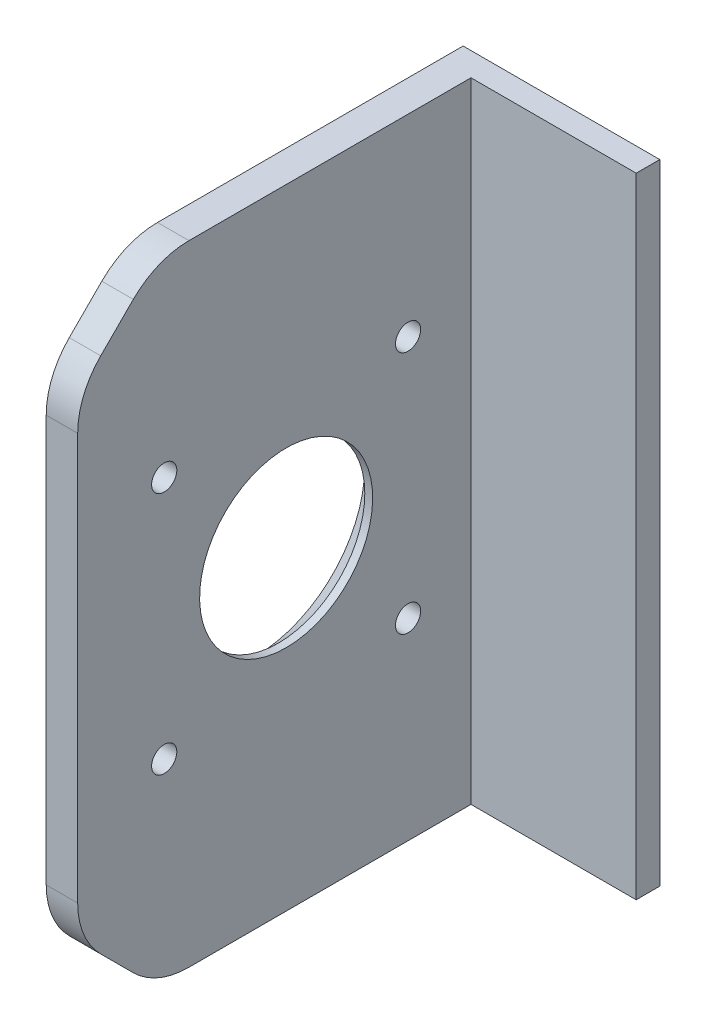
from build123d import *

# Parameters (mm, degrees)
CROQUIS1_W              = 25
CROQUIS1_H              = 80
SALIENTE_EXTRUIR1_DEPTH = 3
CROQUIS2_W              = 4
CROQUIS2_H              = 80
SALIENTE_EXTRUIR2_DEPTH = 50
CHAFL_N1_SIZE           = 10
REDONDEO1_R             = 10
CROQUIS3_R              = 1.6
CROQUIS3_R_2            = 11
CORTAR_EXTRUIR1_DEPTH   = 50
CHAFL_N2_SIZE           = 3


with BuildPart() as part:
    # Croquis1 → Saliente-Extruir1 (new body)
    with BuildSketch(Plane.XY):
        Rectangle(CROQUIS1_W, CROQUIS1_H)
    extrude(amount=SALIENTE_EXTRUIR1_DEPTH)

    # Croquis2 → Saliente-Extruir2 (add)
    with BuildSketch(Plane.XY.offset(3)):
        with Locations((-10.5, 0)):
            Rectangle(CROQUIS2_W, CROQUIS2_H)
    extrude(amount=SALIENTE_EXTRUIR2_DEPTH)

    # Chaflán1
    chafl_n1_edges = [part.edges().sort_by_distance(p)[0] for p in [
        (-10.5, -40, 53),
        (-10.5, 40, 53),
    ]]
    chamfer(chafl_n1_edges, length=CHAFL_N1_SIZE)

    # Redondeo1
    redondeo1_edges = [part.edges().sort_by_distance(p)[0] for p in [
        (-10.5, 30, 53),
        (-10.5, -30, 53),
        (-10.5, -40, 43),
        (-10.5, 40, 43),
    ]]
    fillet(redondeo1_edges, radius=REDONDEO1_R)

    # Croquis3 → Cortar-Extruir1 (cut)
    with BuildSketch(Plane.ZY.offset(12.5)):
        with Locations((11, 15.5)):
            Circle(CROQUIS3_R)
        with Locations((42, 15.5)):
            Circle(CROQUIS3_R)
        with Locations((11, -15.5)):
            Circle(CROQUIS3_R)
        with Locations((42, -15.5)):
            Circle(CROQUIS3_R)
        with Locations((26.5, 0)):
            Circle(CROQUIS3_R_2)
    extrude(amount=-CORTAR_EXTRUIR1_DEPTH, mode=Mode.SUBTRACT)

    # Chaflán2
    chafl_n2_edges = [part.edges().sort_by_distance(p)[0] for p in [
        (-12.5, 0, 15.5),
    ]]
    chamfer(chafl_n2_edges, length=CHAFL_N2_SIZE)


solid = part.part
